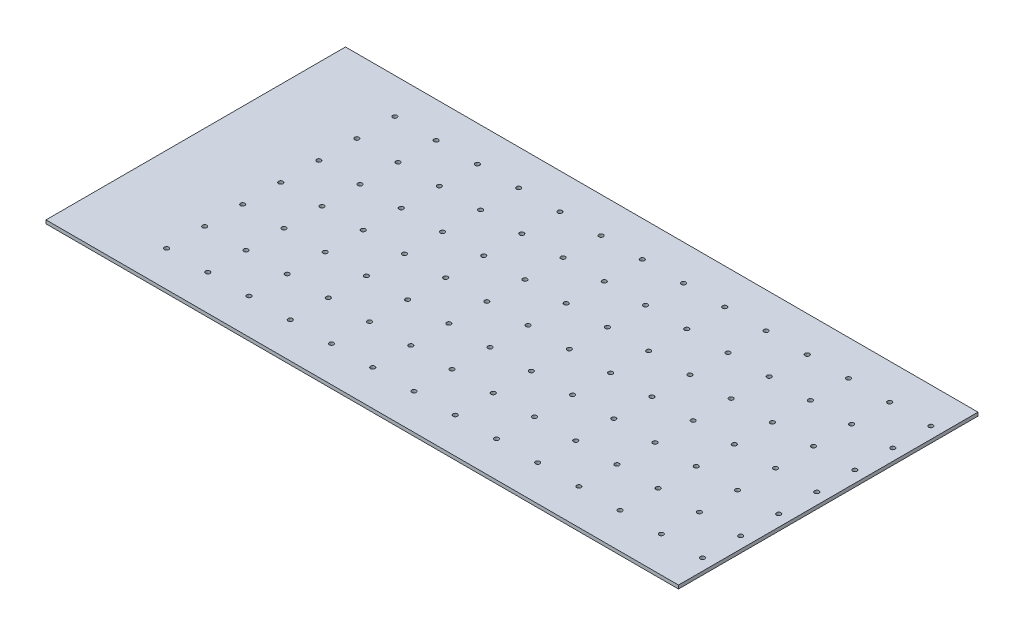
from build123d import *

# Parameters (mm, degrees)
SKETCH1_W            = 540
SKETCH1_H            = 258.64
BOSS_EXTRUDE1_DEPTH  = 3.18
CUT_EXTRUDE1_REACH   = 301.389
SKETCH2_R            = 2
LPATTERN1_COUNT      = 14
LPATTERN1_PITCH      = 37.81
LPATTERN1_COUNT_DIR2 = 7
LPATTERN1_PITCH_DIR2 = 34.9
SKETCH4_W            = 258.64
SKETCH4_H            = 3.18
BOSS_EXTRUDE2_DEPTH  = 40
SKETCH5_W            = 580
SKETCH5_H            = 3.18
BOSS_EXTRUDE3_DEPTH  = 8


with BuildPart() as part:
    # Sketch1 → Boss-Extrude1 (new body)
    with BuildSketch(Plane(origin=(0, 0, 0), x_dir=(1, 0, 0), z_dir=(0, 1, 0))):
        Rectangle(SKETCH1_W, SKETCH1_H)
    extrude(amount=BOSS_EXTRUDE1_DEPTH)

    # Sketch2 → Cut-Extrude1 (cut, up to next)
    with BuildSketch(Plane(origin=(0, 3.18, 0), x_dir=(1, 0, 0), z_dir=(0, 1, 0)), mode=Mode.PRIVATE) as cut_extrude1_sk1:
        with Locations(Location((-232.08, 104.72, 0), (0, 0, 270))):
            Circle(SKETCH2_R)
    cut_extrude1_tool1 = extrude(cut_extrude1_sk1.sketch, amount=-CUT_EXTRUDE1_REACH, mode=Mode.PRIVATE) & part.part
    cut_extrude1 = cut_extrude1_tool1.solids().sort_by_distance((-232.08, 3.18, -104.72))[0]
    add(cut_extrude1, mode=Mode.SUBTRACT)

    # LPattern1: Cut-Extrude1 14 × 7
    with Locations(*[(i * LPATTERN1_PITCH, 0, j * LPATTERN1_PITCH_DIR2) for i in range(LPATTERN1_COUNT) for j in range(LPATTERN1_COUNT_DIR2) if (i, j) != (0, 0)]):
        add(cut_extrude1, mode=Mode.SUBTRACT)

    # Sketch4 → Boss-Extrude2 (add)
    with BuildSketch(Plane.ZY.offset(270)):
        with Locations((0, 1.59)):
            Rectangle(SKETCH4_W, SKETCH4_H)
    extrude(amount=BOSS_EXTRUDE2_DEPTH)

    # Sketch5 → Boss-Extrude3 (add)
    with BuildSketch(Plane.XY.offset(129.32)):
        with Locations((-20, 1.59)):
            Rectangle(SKETCH5_W, SKETCH5_H)
    boss_extrude3 = extrude(amount=BOSS_EXTRUDE3_DEPTH)

    # Mirror1: Boss-Extrude3 across plane
    add(boss_extrude3.mirror(Plane.XY))


solid = part.part
